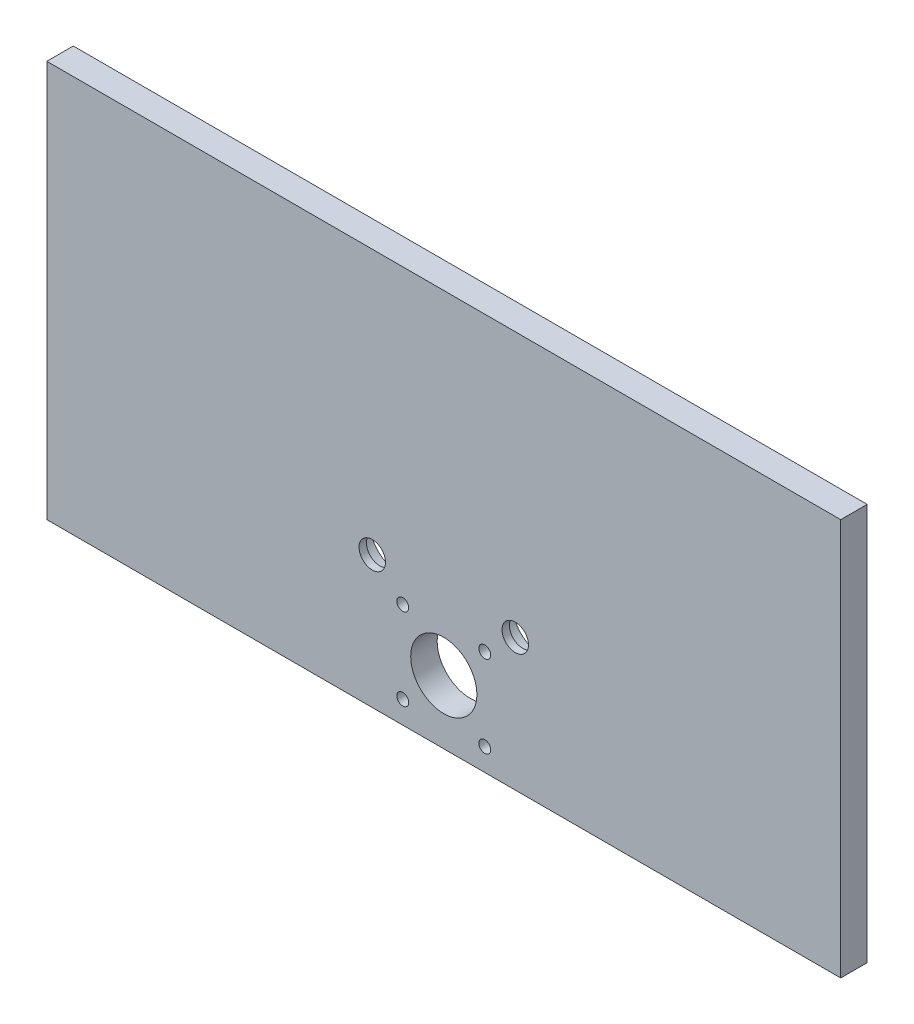
from build123d import *

# Parameters (mm, degrees)
SKETCH1_W                = 300
SKETCH1_H                = 150
BOSS_EXTRUDE1_DEPTH      = 10
SKETCH2_R                = 12.5
CUT_EXTRUDE1_DEPTH       = 169.002976164
M4_CLEARANCE_HOLE1_D     = 4.5
M4_CLEARANCE_HOLE1_DEPTH = 21
M4_CLEARANCE_HOLE1_TIP   = 1.351936393
SKETCH5_R                = 5
CUT_EXTRUDE2_DEPTH       = 169.002976164
SKETCH6_R                = 11
CUT_EXTRUDE3_DEPTH       = 7.2


with BuildPart() as part:
    # Sketch1 → Boss-Extrude1 (new body)
    with BuildSketch(Plane.XY):
        Rectangle(SKETCH1_W, SKETCH1_H)
    extrude(amount=BOSS_EXTRUDE1_DEPTH)

    # Sketch2 → Cut-Extrude1 (cut, through all)
    with BuildSketch(Plane(origin=(0, 0, 0), x_dir=(-1, 0, 0), z_dir=(0, 0, -1))):
        with Locations((0, -51)):
            Circle(SKETCH2_R)
    extrude(amount=-CUT_EXTRUDE1_DEPTH, mode=Mode.SUBTRACT)

    # M4 Clearance Hole1
    with Locations(Plane.XY.offset(10)):
        with Locations((-15.5, -35.5), (15.5, -35.5), (15.5, -66.5), (-15.5, -66.5)):
            Hole(M4_CLEARANCE_HOLE1_D / 2, depth=M4_CLEARANCE_HOLE1_DEPTH)
            with Locations((0, 0, -(M4_CLEARANCE_HOLE1_DEPTH + M4_CLEARANCE_HOLE1_TIP / 2))):  # 118° drill point
                Cone(0, M4_CLEARANCE_HOLE1_D / 2, M4_CLEARANCE_HOLE1_TIP, mode=Mode.SUBTRACT)

    # Sketch5 → Cut-Extrude2 (cut, through all)
    with BuildSketch(Plane.XY.offset(10)):
        with Locations((27.013718503, -25)):
            Circle(SKETCH5_R)
    cut_extrude2 = extrude(amount=-CUT_EXTRUDE2_DEPTH, mode=Mode.SUBTRACT)

    # Mirror1: Cut-Extrude2 across plane
    add(cut_extrude2.mirror(Plane(origin=(0, 0, 0), x_dir=(0, 0, 1), z_dir=(1, 0, 0))), mode=Mode.SUBTRACT)

    # Sketch6 → Cut-Extrude3 (cut)
    with BuildSketch(Plane(origin=(0, 0, 0), x_dir=(-1, 0, 0), z_dir=(0, 0, -1))):
        with Locations((-27.013718503, -25)):
            Circle(SKETCH6_R)
        with Locations((27.013718503, -25)):
            Circle(SKETCH6_R)
    extrude(amount=-CUT_EXTRUDE3_DEPTH, mode=Mode.SUBTRACT)


solid = part.part
